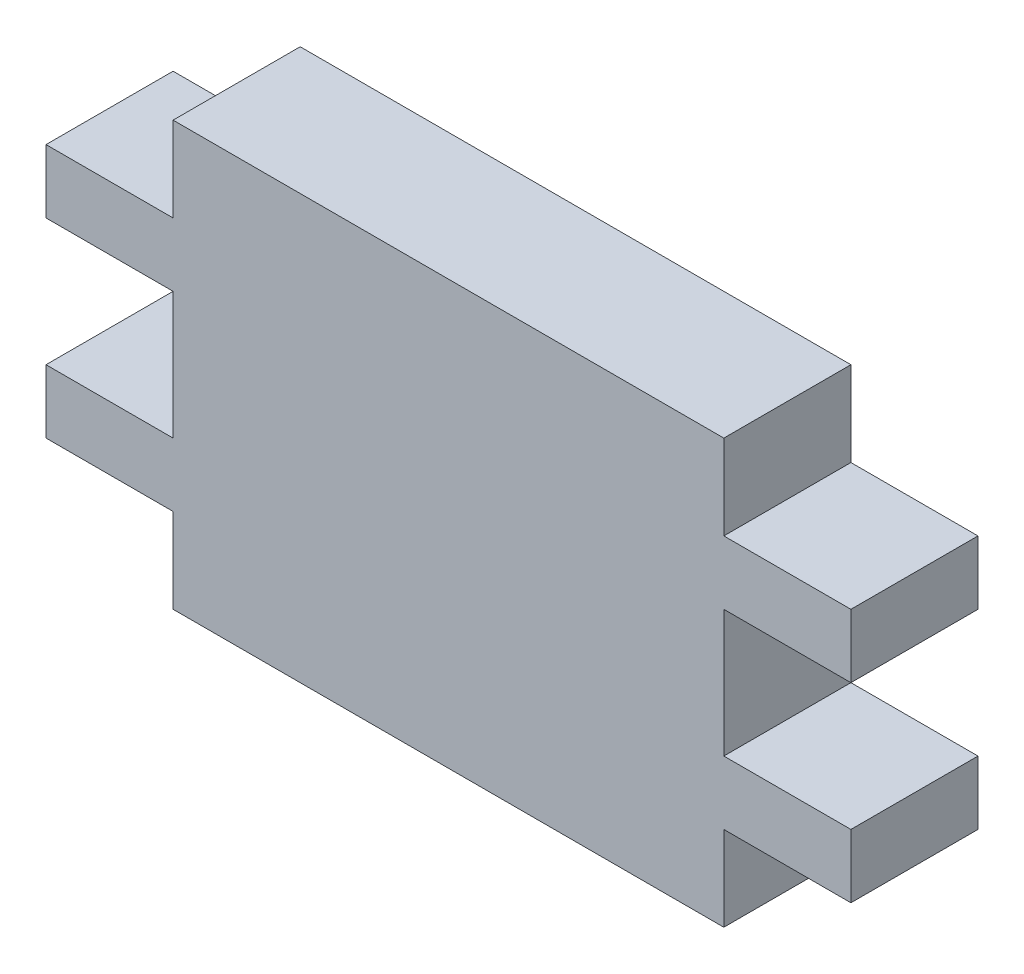
from build123d import *

# Parameters (mm, degrees)
SKETCH1_W           = 19
SKETCH1_H           = 10
BOSS_EXTRUDE1_DEPTH = 3
SKETCH2_W           = 3
SKETCH2_H           = 2
SKETCH2_H_2         = 3
CUT_EXTRUDE1_DEPTH  = 3
SKETCH3_W           = 3
SKETCH3_H           = 2
SKETCH3_H_2         = 3
CUT_EXTRUDE2_DEPTH  = 3


with BuildPart() as part:
    # Sketch1 → Boss-Extrude1 (new body)
    with BuildSketch(Plane.XY):
        Rectangle(SKETCH1_W, SKETCH1_H)
    extrude(amount=BOSS_EXTRUDE1_DEPTH)

    # Sketch2 → Cut-Extrude1 (cut)
    with BuildSketch(Plane.XY.offset(3)):
        with Locations((-8, 4)):
            Rectangle(SKETCH2_W, SKETCH2_H)
        with Locations((-8, 0)):
            Rectangle(SKETCH2_W, SKETCH2_H_2)
        with Locations((-8, -4)):
            Rectangle(SKETCH2_W, SKETCH2_H)
    extrude(amount=-CUT_EXTRUDE1_DEPTH, mode=Mode.SUBTRACT)

    # Sketch3 → Cut-Extrude2 (cut)
    with BuildSketch(Plane.XY.offset(3)):
        with Locations((8, 4)):
            Rectangle(SKETCH3_W, SKETCH3_H)
        with Locations((8, 0)):
            Rectangle(SKETCH3_W, SKETCH3_H_2)
        with Locations((8, -4)):
            Rectangle(SKETCH3_W, SKETCH3_H)
    extrude(amount=-CUT_EXTRUDE2_DEPTH, mode=Mode.SUBTRACT)


solid = part.part
